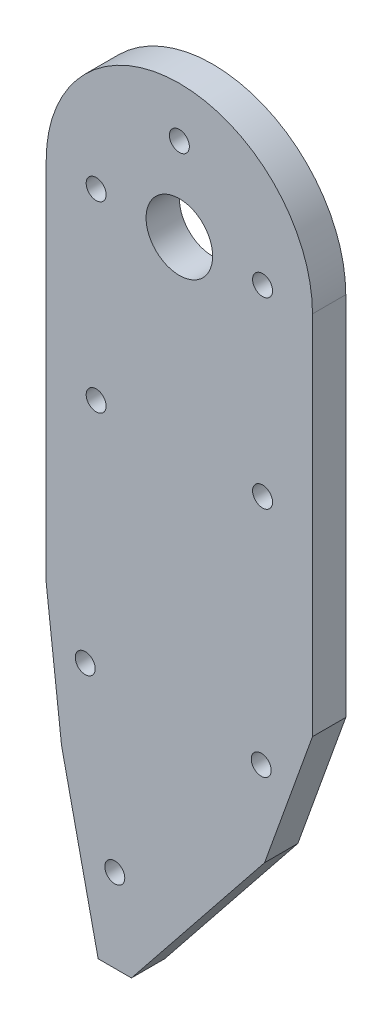
from build123d import *

# Parameters (mm, degrees)
EXTRUDE_1_DEPTH     = 5
SKETCH_2_R          = 5
CUT_EXTRUDE_1_DEPTH = 5
CUT_EXTRUDE_2_REACH = 75.385
SKETCH_3_R          = 1.5


with BuildPart() as part:
    # 草图1 → 凸台-拉伸1 (new body)
    with BuildSketch(Plane.XY):
        with BuildLine():
            Line((-22.282205337, 49.741076161), (-22.282205337, -5.258923839))
            Line((-22.282205337, -5.258923839), (-19.982205337, -25.258923839))
            Line((-19.982205337, -25.258923839), (-14.482205337, -50.258923839))
            Line((-14.482205337, -50.258923839), (-9.482205337, -50.258923839))
            Line((-9.482205337, -50.258923839), (10.517794663, -25.258923839))
            Line((10.517794663, -25.258923839), (17.717794663, -5.258923839))
            Line((17.717794663, -5.258923839), (17.717794663, 49.741076161))
            ThreePointArc((17.717794663, 49.741076161), (-2.282205337, 69.741076161), (-22.282205337, 49.741076161))
        make_face()
    extrude(amount=EXTRUDE_1_DEPTH)

    # 草图2 → 切除-拉伸1 (cut)
    with BuildSketch(Plane.XY.offset(5)):
        with Locations((-2.282205337, 49.741076161)):
            Circle(SKETCH_2_R)
    extrude(amount=-CUT_EXTRUDE_1_DEPTH, mode=Mode.SUBTRACT)

    # 草图3 → 切除-拉伸2 (cut, up to next)
    with BuildSketch(Plane.XY.offset(5), mode=Mode.PRIVATE) as cut_extrude_2_sk1:
        with Locations((-11.982205337, -37.758923839)):
            Circle(SKETCH_3_R)
    cut_extrude_2_tool1 = extrude(cut_extrude_2_sk1.sketch, amount=-CUT_EXTRUDE_2_REACH, mode=Mode.PRIVATE) & part.part
    # 草图3 → 切除-拉伸2 (cut, up to next)
    with BuildSketch(Plane.XY.offset(5), mode=Mode.PRIVATE) as cut_extrude_2_sk2:
        with Locations((-14.782205337, 49.741076161)):
            Circle(SKETCH_3_R)
    cut_extrude_2_tool2 = extrude(cut_extrude_2_sk2.sketch, amount=-CUT_EXTRUDE_2_REACH, mode=Mode.PRIVATE) & part.part
    # 草图3 → 切除-拉伸2 (cut, up to next)
    with BuildSketch(Plane.XY.offset(5), mode=Mode.PRIVATE) as cut_extrude_2_sk3:
        with Locations((10.217794663, 49.741076161)):
            Circle(SKETCH_3_R)
    cut_extrude_2_tool3 = extrude(cut_extrude_2_sk3.sketch, amount=-CUT_EXTRUDE_2_REACH, mode=Mode.PRIVATE) & part.part
    # 草图3 → 切除-拉伸2 (cut, up to next)
    with BuildSketch(Plane.XY.offset(5), mode=Mode.PRIVATE) as cut_extrude_2_sk4:
        with Locations((-2.282205337, 62.241076161)):
            Circle(SKETCH_3_R)
    cut_extrude_2_tool4 = extrude(cut_extrude_2_sk4.sketch, amount=-CUT_EXTRUDE_2_REACH, mode=Mode.PRIVATE) & part.part
    # 草图3 → 切除-拉伸2 (cut, up to next)
    with BuildSketch(Plane.XY.offset(5), mode=Mode.PRIVATE) as cut_extrude_2_sk5:
        with Locations((10.217794663, 22.241076161)):
            Circle(SKETCH_3_R)
    cut_extrude_2_tool5 = extrude(cut_extrude_2_sk5.sketch, amount=-CUT_EXTRUDE_2_REACH, mode=Mode.PRIVATE) & part.part
    # 草图3 → 切除-拉伸2 (cut, up to next)
    with BuildSketch(Plane.XY.offset(5), mode=Mode.PRIVATE) as cut_extrude_2_sk6:
        with Locations((-14.782205337, 22.241076161)):
            Circle(SKETCH_3_R)
    cut_extrude_2_tool6 = extrude(cut_extrude_2_sk6.sketch, amount=-CUT_EXTRUDE_2_REACH, mode=Mode.PRIVATE) & part.part
    # 草图3 → 切除-拉伸2 (cut, up to next)
    with BuildSketch(Plane.XY.offset(5), mode=Mode.PRIVATE) as cut_extrude_2_sk7:
        with Locations((-16.419705337, -12.758923839)):
            Circle(SKETCH_3_R)
    cut_extrude_2_tool7 = extrude(cut_extrude_2_sk7.sketch, amount=-CUT_EXTRUDE_2_REACH, mode=Mode.PRIVATE) & part.part
    # 草图3 → 切除-拉伸2 (cut, up to next)
    with BuildSketch(Plane.XY.offset(5), mode=Mode.PRIVATE) as cut_extrude_2_sk8:
        with Locations((10.017794663, -12.758923839)):
            Circle(SKETCH_3_R)
    cut_extrude_2_tool8 = extrude(cut_extrude_2_sk8.sketch, amount=-CUT_EXTRUDE_2_REACH, mode=Mode.PRIVATE) & part.part
    add(cut_extrude_2_tool1.solids().sort_by_distance((-11.982205, -37.758924, 5))[0], mode=Mode.SUBTRACT)
    add(cut_extrude_2_tool2.solids().sort_by_distance((-14.782205, 49.741076, 5))[0], mode=Mode.SUBTRACT)
    add(cut_extrude_2_tool3.solids().sort_by_distance((10.217795, 49.741076, 5))[0], mode=Mode.SUBTRACT)
    add(cut_extrude_2_tool4.solids().sort_by_distance((-2.282205, 62.241076, 5))[0], mode=Mode.SUBTRACT)
    add(cut_extrude_2_tool5.solids().sort_by_distance((10.217795, 22.241076, 5))[0], mode=Mode.SUBTRACT)
    add(cut_extrude_2_tool6.solids().sort_by_distance((-14.782205, 22.241076, 5))[0], mode=Mode.SUBTRACT)
    add(cut_extrude_2_tool7.solids().sort_by_distance((-16.419705, -12.758924, 5))[0], mode=Mode.SUBTRACT)
    add(cut_extrude_2_tool8.solids().sort_by_distance((10.017795, -12.758924, 5))[0], mode=Mode.SUBTRACT)


solid = part.part
